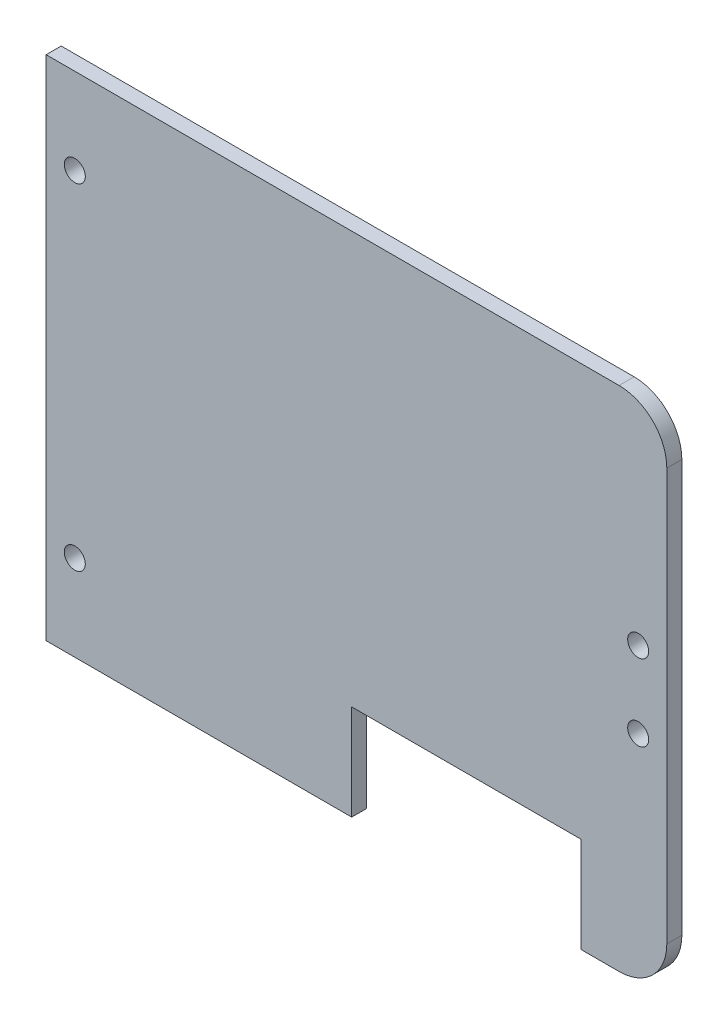
from build123d import *

# Parameters (mm, degrees)
BPR2_PCB_OUTLINE_R  = 1.1
BOSS_EXTRUDE1_DEPTH = 1.5748


with BuildPart() as part:
    # BPR2 PCB Outline → Boss-Extrude1 (new body)
    with BuildSketch(Plane.XY):
        with BuildLine():
            Line((0, 0), (0, 53.15))
            Line((0, 53.15), (60, 53.15))
            ThreePointArc((60, 53.15), (63.535533906, 51.685533906), (65, 48.15))
            Line((65, 48.15), (65, 5))
            ThreePointArc((65, 5), (63.535533906, 1.464466094), (60, 0))
            Line((60, 0), (56, 0))
            Line((56, 0), (56, 10))
            Line((56, 10), (32, 10))
            Line((32, 10), (32, 0))
            Line((32, 0), (0, 0))
        make_face()
        with Locations((3, 9)):
            Circle(BPR2_PCB_OUTLINE_R, mode=Mode.SUBTRACT)
        with Locations((62, 22.575)):
            Circle(BPR2_PCB_OUTLINE_R, mode=Mode.SUBTRACT)
        with Locations((3, 44.15)):
            Circle(BPR2_PCB_OUTLINE_R, mode=Mode.SUBTRACT)
        with Locations((62, 30.575)):
            Circle(BPR2_PCB_OUTLINE_R, mode=Mode.SUBTRACT)
    extrude(amount=-BOSS_EXTRUDE1_DEPTH)


solid = part.part
